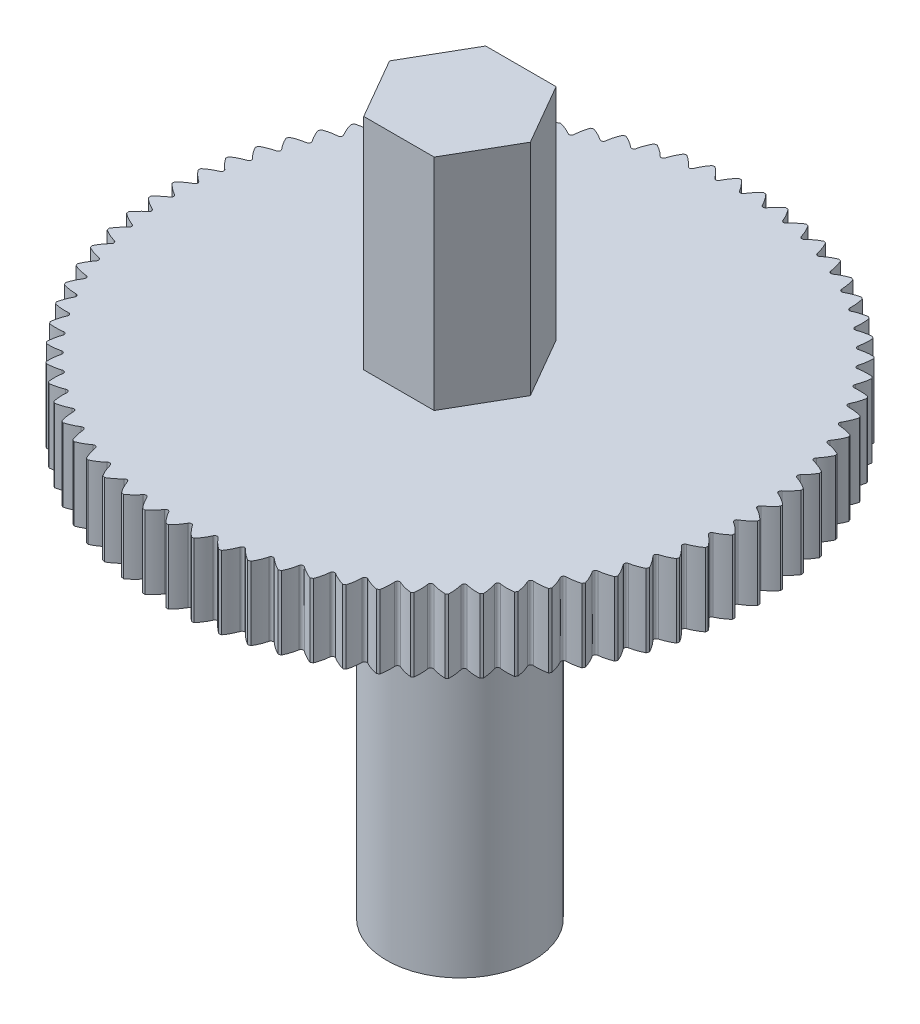
from build123d import *

# Parameters (mm, degrees)
CUT_EXTRUDE2_DEPTH = 10
CIRPATTERN1_COUNT  = 75
CUT_EXTRUDE3_START = -9
SKETCH3_R          = 3
CUT_EXTRUDE3_DEPTH = 9


with BuildPart() as part:
    # Sketch1 → Revolve1 (revolve)
    with BuildSketch(Plane.XY, mode=Mode.PRIVATE) as revolve1_sk:
        Polygon((0, 0), (0, 29), (3, 29), (3, 20), (12, 20), (12, 17), (3, 17), (3, 0), align=None)
    revolve(revolve1_sk.sketch.rotate(Axis((0, 0, 0), (0, 1, 0)), 90), axis=Axis((0, 0, 0), (0, 1, 0)))

    # Sketch2 → Cut-Extrude2 (cut)
    with BuildSketch(Plane(origin=(0, 20, 0), x_dir=(1, 0, 0), z_dir=(0, 1, 0))):
        with BuildLine():
            Line((0.460139062, 12.000716166), (-0.460139062, 12.000716166))
            ThreePointArc((-0.460139062, 12.000716166), (-0.25900098, 11.792110565), (-0.09011968, 11.556628228))
            ThreePointArc((-0.09011968, 11.556628228), (0, 11.49996924), (0.09011968, 11.556628228))
            ThreePointArc((0.09011968, 11.556628228), (0.25900098, 11.792110565), (0.460139062, 12.000716166))
        make_face()
    cut_extrude2 = extrude(amount=-CUT_EXTRUDE2_DEPTH, mode=Mode.SUBTRACT)

    # CirPattern1: Cut-Extrude2 ×75 about axis
    cirpattern1_axis = Axis((0, 0, 0), (0, 1, 0))
    for i in range(1, CIRPATTERN1_COUNT):
        add(cut_extrude2.rotate(cirpattern1_axis, i * 360 / CIRPATTERN1_COUNT), mode=Mode.SUBTRACT)

    # Sketch3 → Cut-Extrude3 (cut)
    with BuildSketch(Plane(origin=(0, 29, 0), x_dir=(1, 0, 0), z_dir=(0, 1, 0)).offset(CUT_EXTRUDE3_START)):
        with Locations(Location((0, 0, 0), (0, 0, 90))):
            Circle(SKETCH3_R)
        Polygon((2.886751346, 0), (1.443375673, 2.5), (-1.443375673, 2.5), (-2.886751346, 0), (-1.443375673, -2.5), (1.443375673, -2.5), align=None, mode=Mode.SUBTRACT)
    extrude(amount=CUT_EXTRUDE3_DEPTH, mode=Mode.SUBTRACT)


solid = part.part
